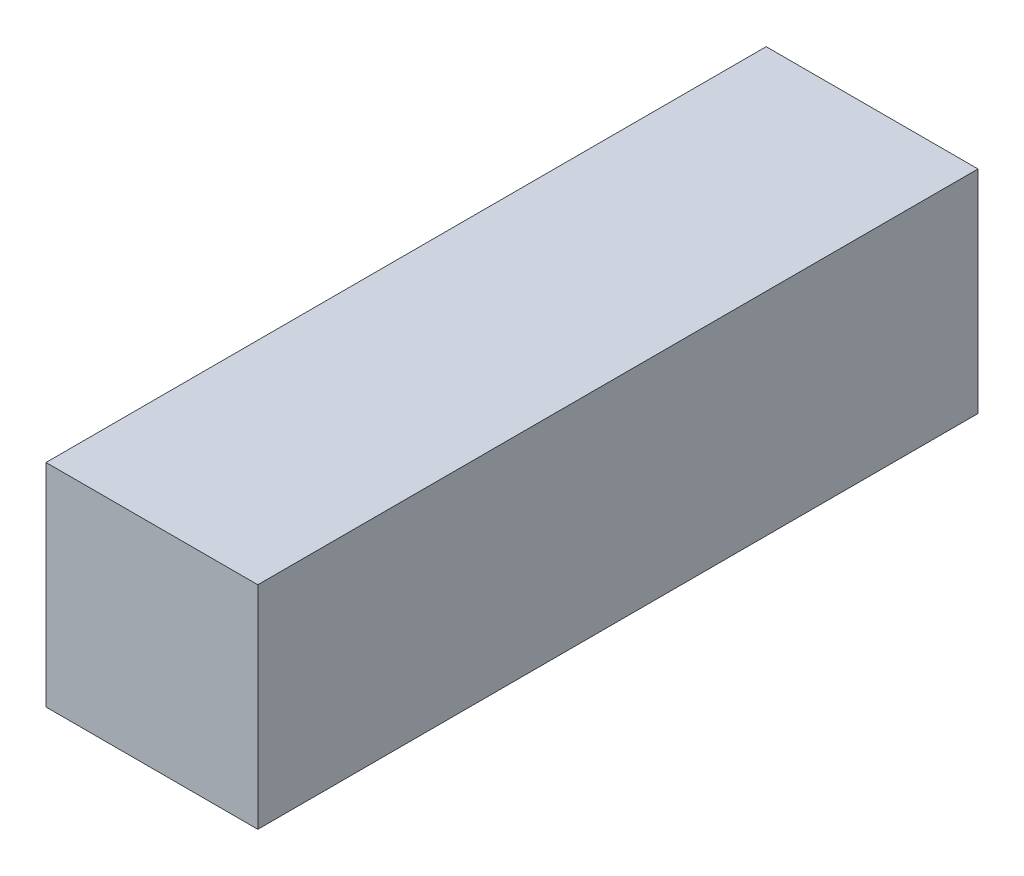
from build123d import *

# Parameters (mm, degrees)
SKETCH1_W           = 20
SKETCH1_H           = 20
BOSS_EXTRUDE1_DEPTH = 68


with BuildPart() as part:
    # Sketch1 → Boss-Extrude1 (new body)
    with BuildSketch(Plane.XY):
        with Locations((-22, 22)):
            Rectangle(SKETCH1_W, SKETCH1_H)
    extrude(amount=BOSS_EXTRUDE1_DEPTH)


solid = part.part
